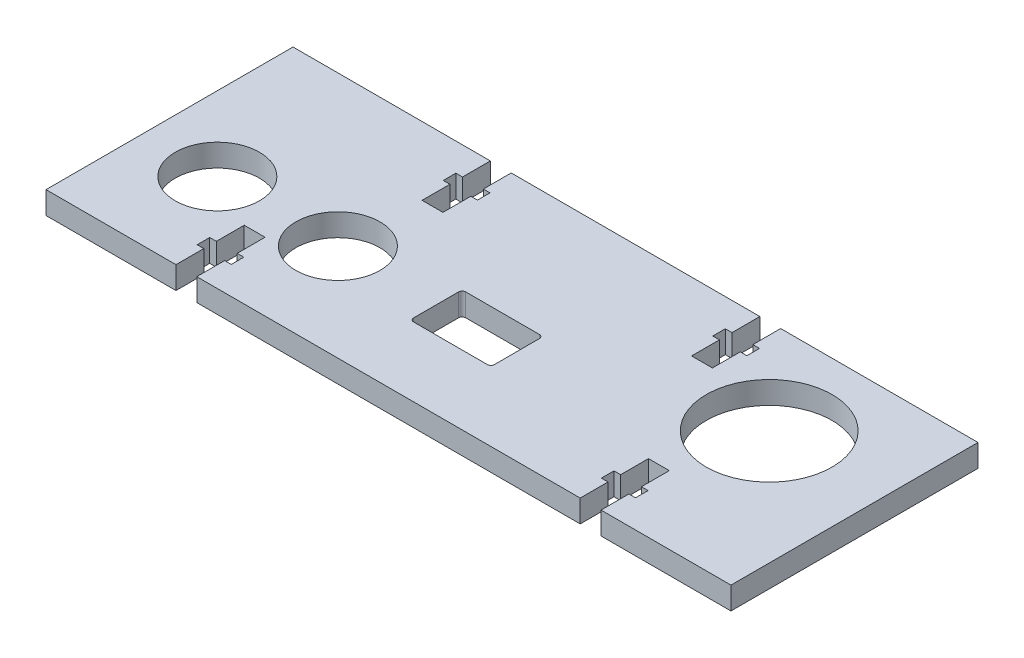
from build123d import *

# Parameters (mm, degrees)
SKETCH1_W                = 96.8375
SKETCH1_H                = 34.925
BOSS_EXTRUDE1_DEPTH      = 3.175
F_7_16_CLEARANCE_HOLE1_D = 11.90498
SKETCH6_W                = 11.43
SKETCH6_H                = 7.366
CUT_EXTRUDE1_DEPTH       = 52.56932114
CUT_EXTRUDE3_DEPTH       = 52.56932114
SKETCH9_R                = 8.89
CUT_EXTRUDE4_DEPTH       = 52.56932114
FILLET1_R                = 0.508


with BuildPart() as part:
    # Sketch1 → Boss-Extrude1 (new body)
    with BuildSketch(Plane(origin=(0, 0, 0), x_dir=(1, 0, 0), z_dir=(0, 1, 0))):
        Rectangle(SKETCH1_W, SKETCH1_H)
    extrude(amount=BOSS_EXTRUDE1_DEPTH)

    # 7/16 Clearance Hole1 (through all)
    with Locations(Plane(origin=(0, 3.175, 0), x_dir=(1, 0, 0), z_dir=(0, 1, 0))):
        with Locations((-37.9095, -3.7465), (-20.8661, -3.7465)):
            Hole(F_7_16_CLEARANCE_HOLE1_D / 2)

    # Sketch6 → Cut-Extrude1 (cut, through all)
    with BuildSketch(Plane(origin=(0, 3.175, 0), x_dir=(1, 0, 0), z_dir=(0, 1, 0))):
        with Locations((-1.016, -4.0005)):
            Rectangle(SKETCH6_W, SKETCH6_H)
    extrude(amount=-CUT_EXTRUDE1_DEPTH, mode=Mode.SUBTRACT)

    # Sketch8 → Cut-Extrude3 (cut, through all)
    with BuildSketch(Plane(origin=(0, 3.175, 0), x_dir=(1, 0, 0), z_dir=(0, 1, 0))):
        Polygon((27.1018, -17.4625), (30.0482, -17.4625), (30.0482, -13.5255), (30.988, -13.5255), (30.988, -11.7475), (30.0482, -11.7475), (30.0482, -7.8105), (27.1018, -7.8105), (27.1018, -11.7475), (26.162, -11.7475), (26.162, -13.5255), (27.1018, -13.5255), align=None)
        Polygon((-30.0482, -17.4625), (-27.1018, -17.4625), (-27.1018, -13.5255), (-26.162, -13.5255), (-26.162, -11.7475), (-27.1018, -11.7475), (-27.1018, -7.8105), (-30.0482, -7.8105), (-30.0482, -11.7475), (-30.988, -11.7475), (-30.988, -13.5255), (-30.0482, -13.5255), align=None)
        Polygon((17.5768, 11.7475), (17.5768, 7.8105), (20.5232, 7.8105), (20.5232, 11.7475), (21.463, 11.7475), (21.463, 13.5255), (20.5232, 13.5255), (20.5232, 17.4625), (17.5768, 17.4625), (17.5768, 13.5255), (16.637, 13.5255), (16.637, 11.7475), align=None)
        Polygon((-20.5232, 11.7475), (-20.5232, 7.8105), (-17.5768, 7.8105), (-17.5768, 11.7475), (-16.637, 11.7475), (-16.637, 13.5255), (-17.5768, 13.5255), (-17.5768, 17.4625), (-20.5232, 17.4625), (-20.5232, 13.5255), (-21.463, 13.5255), (-21.463, 11.7475), align=None)
    extrude(amount=-CUT_EXTRUDE3_DEPTH, mode=Mode.SUBTRACT)

    # Sketch9 → Cut-Extrude4 (cut, through all)
    with BuildSketch(Plane(origin=(0, 3.175, 0), x_dir=(1, 0, 0), z_dir=(0, 1, 0))):
        with Locations(Location((32.2326, 4.1275, 0), (0, 0, 270))):
            Circle(SKETCH9_R)
    extrude(amount=-CUT_EXTRUDE4_DEPTH, mode=Mode.SUBTRACT)

    # Fillet1
    fillet1_edges = [part.edges().sort_by_distance(p)[0] for p in [
        (4.699, 1.5875, 0.3175),
        (4.699, 1.5875, 7.6835),
        (-6.731, 1.5875, 7.6835),
        (-6.731, 1.5875, 0.3175),
    ]]
    fillet(fillet1_edges, radius=FILLET1_R)


solid = part.part
